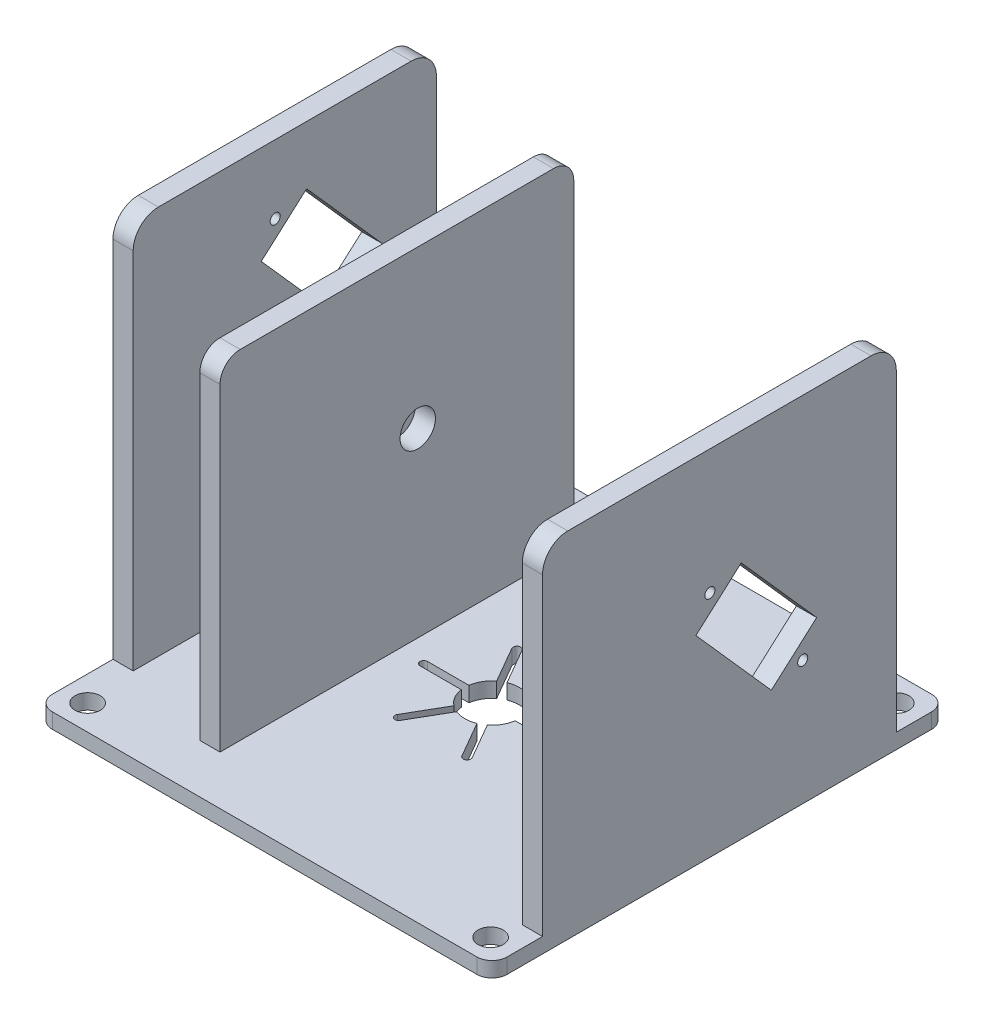
from build123d import *

# Parameters (mm, degrees)
SKETCH1_W           = 4
SKETCH1_H           = 70
SKETCH1_H_2         = 60
BOSS_EXTRUDE1_DEPTH = 3
SKETCH1_3_W         = 4
SKETCH1_3_H         = 60
SKETCH1_3_H_2       = 70
BOSS_EXTRUDE2_DEPTH = 70
SKETCH1_4_W         = 4
SKETCH1_4_H         = 70
BOSS_EXTRUDE3_DEPTH = 70
SKETCH5_R           = 4
CUT_EXTRUDE4_DEPTH  = 10
SKETCH6_R           = 2.5
CUT_EXTRUDE5_DEPTH  = 10
SKETCH1_5_W         = 4
SKETCH1_5_H         = 60
BOSS_EXTRUDE4_DEPTH = 80
SKETCH5_2_R         = 4
CUT_EXTRUDE6_DEPTH  = 10
FILLET1_R           = 3
FILLET2_R           = 5
FILLET3_R           = 4
SKETCH7_R           = 2.5
CUT_EXTRUDE7_DEPTH  = 10
SKETCH8_R           = 2.5
CUT_EXTRUDE8_DEPTH  = 10
CUT_EXTRUDE9_REACH  = 132.084
SKETCH9_R           = 3.5
SKETCH26_R          = 2.5
CUT_EXTRUDE11_DEPTH = 10
CUT_EXTRUDE14_DEPTH = 10
CUT_EXTRUDE15_DEPTH = 10
SKETCH28_R          = 1
SKETCH28_R_2        = 4
CUT_EXTRUDE16_DEPTH = 4
SKETCH29_R          = 1
SKETCH29_R_2        = 3.5
CUT_EXTRUDE18_DEPTH = 4
SKETCH31_R          = 5.375
CUT_EXTRUDE19_DEPTH = 10


with BuildPart() as part:
    # Sketch1 → Boss-Extrude1 (new body)
    # profile 1 of 4: a face of its own
    with BuildSketch(Plane(origin=(0, 0, 0), x_dir=(1, 0, 0), z_dir=(0, 1, 0))):
        Polygon((-50.771305032, 49.212548619), (-50.771305032, 34.212548619), (-46.771305032, 34.212548619), (-46.771305032, -25.787451381), (-50.771305032, -25.787451381), (-50.771305032, -40.787451381), (39.228694968, -40.787451381), (39.228694968, -30.787451381), (35.228694968, -30.787451381), (35.228694968, 39.212548619), (39.228694968, 39.212548619), (39.228694968, 49.212548619), align=None)
        with Locations((-26.271305032, 3.893815937)):
            Rectangle(SKETCH1_W, SKETCH1_H, mode=Mode.SUBTRACT)
    # profile 2 of 4: a face of its own
    with BuildSketch(Plane(origin=(0, 0, 0), x_dir=(1, 0, 0), z_dir=(0, 1, 0))):
        with Locations((37.228694968, 4.212548619)):
            Rectangle(SKETCH1_W, SKETCH1_H)
    # profile 3 of 4: a face of its own
    with BuildSketch(Plane(origin=(0, 0, 0), x_dir=(1, 0, 0), z_dir=(0, 1, 0))):
        with Locations((-48.771305032, 4.212548619)):
            Rectangle(SKETCH1_W, SKETCH1_H_2)
    # profile 4 of 4: a face of its own
    with BuildSketch(Plane(origin=(0, 0, 0), x_dir=(1, 0, 0), z_dir=(0, 1, 0))):
        with Locations((-26.271305032, 3.893815937)):
            Rectangle(SKETCH1_W, SKETCH1_H)
    extrude(amount=BOSS_EXTRUDE1_DEPTH)

    # Sketch1<3> → Boss-Extrude2 (add)
    with BuildSketch(Plane(origin=(0, 0, 0), x_dir=(1, 0, 0), z_dir=(0, 1, 0))):
        with Locations((-48.771305032, 4.212548619)):
            Rectangle(SKETCH1_3_W, SKETCH1_3_H)
        with Locations((37.228694968, 4.212548619)):
            Rectangle(SKETCH1_3_W, SKETCH1_3_H_2)
    extrude(amount=BOSS_EXTRUDE2_DEPTH)

    # Sketch1<4> → Boss-Extrude3 (add)
    with BuildSketch(Plane(origin=(0, 0, 0), x_dir=(1, 0, 0), z_dir=(0, 1, 0))):
        with Locations((-26.271305032, 3.893815937)):
            Rectangle(SKETCH1_4_W, SKETCH1_4_H)
    extrude(amount=BOSS_EXTRUDE3_DEPTH)

    # Sketch5 → Cut-Extrude4 (cut)
    with BuildSketch(Plane.ZY.offset(50.771305032)):
        with Locations((-8.022548619, 60)):
            Circle(SKETCH5_R)
    extrude(amount=-CUT_EXTRUDE4_DEPTH, mode=Mode.SUBTRACT)

    # Sketch6 → Cut-Extrude5 (cut)
    with BuildSketch(Plane(origin=(0, 3, 0), x_dir=(1, 0, 0), z_dir=(0, 1, 0))):
        with Locations(Location((-45.787574368, -35.787451381, 0), (0, 0, 270))):
            Circle(SKETCH6_R)
        with Locations(Location((-45.787574368, 44.212548619, 0), (0, 0, 270))):
            Circle(SKETCH6_R)
        with Locations((43.718511914, 44.212548619)):
            Circle(SKETCH6_R)
        with Locations((43.718511914, -35.787451381)):
            Circle(SKETCH6_R)
    extrude(amount=-CUT_EXTRUDE5_DEPTH, mode=Mode.SUBTRACT)

    # Sketch1<5> → Boss-Extrude4 (add)
    with BuildSketch(Plane(origin=(0, 0, 0), x_dir=(1, 0, 0), z_dir=(0, 1, 0))):
        with Locations((-48.771305032, 4.212548619)):
            Rectangle(SKETCH1_5_W, SKETCH1_5_H)
    extrude(amount=BOSS_EXTRUDE4_DEPTH)

    # Sketch5<2> → Cut-Extrude6 (cut)
    with BuildSketch(Plane.ZY.offset(50.771305032)):
        with Locations((-8.022548619, 60)):
            Circle(SKETCH5_2_R)
    extrude(amount=-CUT_EXTRUDE6_DEPTH, mode=Mode.SUBTRACT)

    # Fillet1
    fillet1_edges = [part.edges().sort_by_distance(p)[0] for p in [
        (-50.771305032, 1.5, 40.787451381),
        (-50.771305032, 1.5, -49.212548619),
        (39.228694968, 1.5, -49.212548619),
        (39.228694968, 1.5, 40.787451381),
    ]]
    fillet(fillet1_edges, radius=FILLET1_R)

    # Fillet2
    fillet2_edges = [part.edges().sort_by_distance(p)[0] for p in [
        (-48.771305032, 80, -34.212548619),
        (-48.771305032, 80, 25.787451381),
        (37.228694968, 70, -39.212548619),
        (37.228694968, 70, 30.787451381),
    ]]
    fillet(fillet2_edges, radius=FILLET2_R)

    # Fillet3
    fillet3_edges = [part.edges().sort_by_distance(p)[0] for p in [
        (-26.271305032, 70, 31.106184063),
        (-26.271305032, 70, -38.893815937),
    ]]
    fillet(fillet3_edges, radius=FILLET3_R)

    # Sketch7 → Cut-Extrude7 (cut)
    with BuildSketch(Plane(origin=(39.228694968, 0, 0), x_dir=(0, 0, -1), z_dir=(1, 0, 0))):
        with Locations((27.482306935, -10)):
            Circle(SKETCH7_R)
    extrude(amount=-CUT_EXTRUDE7_DEPTH, mode=Mode.SUBTRACT)

    # Sketch8 → Cut-Extrude8 (cut)
    with BuildSketch(Plane(origin=(39.228694968, 0, 0), x_dir=(0, 0, -1), z_dir=(1, 0, 0))):
        with Locations((8.02072759, 38.893893193)):
            Circle(SKETCH8_R)
    extrude(amount=-CUT_EXTRUDE8_DEPTH, mode=Mode.SUBTRACT)

    # Cut-Extrude9: up to this face of the body (flat: up to its plane)
    cut_extrude9_end = Plane(part.part.faces().sort_by_distance((-28.271305032, 36.452186393, -3.893815937))[0])
    # Sketch9 → Cut-Extrude9 (cut, up to the picked face)
    with BuildSketch(Plane(origin=(39.228694968, 0, 0), x_dir=(0, 0, -1), z_dir=(1, 0, 0)), mode=Mode.PRIVATE) as cut_extrude9_sk1:
        with Locations((8.02072759, 38.893893193)):
            Circle(SKETCH9_R)
    cut_extrude9_tool1 = split(extrude(cut_extrude9_sk1.sketch, amount=-CUT_EXTRUDE9_REACH, mode=Mode.PRIVATE), bisect_by=cut_extrude9_end, keep=Keep.BOTH, mode=Mode.PRIVATE)
    add(cut_extrude9_tool1.solids().sort_by(Axis((39.228695, 38.893893, -8.020728), (-1, 0, 0)))[0], mode=Mode.SUBTRACT)

    # Sketch26 → Cut-Extrude11 (cut)
    with BuildSketch(Plane(origin=(0, 3, 0), x_dir=(1, 0, 0), z_dir=(0, 1, 0))):
        with Locations(Location((34.228694968, -36.063353705, 0), (0, 0, 270))):
            Circle(SKETCH26_R)
        with Locations(Location((34.228694968, 44.212548619, 0), (0, 0, 270))):
            Circle(SKETCH26_R)
    extrude(amount=-CUT_EXTRUDE11_DEPTH, mode=Mode.SUBTRACT)

    # Sketch27 → Cut-Extrude14 (cut)
    with BuildSketch(Plane(origin=(0, 3, 0), x_dir=(1, 0, 0), z_dir=(0, 1, 0))):
        with BuildLine():
            Line((7.728694968, 3.462548619), (-19.271305032, 3.462548619))
            ThreePointArc((-19.271305032, 3.462548619), (-20.021305032, 4.212548619), (-19.271305032, 4.962548619))
            Line((-19.271305032, 4.962548619), (7.728694968, 4.962548619))
            ThreePointArc((7.728694968, 4.962548619), (8.478694968, 4.212548619), (7.728694968, 3.462548619))
        make_face()
        with BuildLine():
            Line((0.329175915, -7.853794332), (-13.170824085, 15.52889157))
            ThreePointArc((-13.170824085, 15.52889157), (-12.896305032, 16.553410623), (-11.871785979, 16.27889157))
            Line((-11.871785979, 16.27889157), (1.628214021, -7.103794332))
            ThreePointArc((1.628214021, -7.103794332), (1.353694968, -8.128313385), (0.329175915, -7.853794332))
        make_face()
        with BuildLine():
            Line((-13.170824085, -7.103794332), (0.329175915, 16.27889157))
            ThreePointArc((0.329175915, 16.27889157), (1.353694968, 16.553410623), (1.628214021, 15.52889157))
            Line((1.628214021, 15.52889157), (-11.871785979, -7.853794332))
            ThreePointArc((-11.871785979, -7.853794332), (-12.896305032, -8.128313385), (-13.170824085, -7.103794332))
        make_face()
    extrude(amount=-CUT_EXTRUDE14_DEPTH, mode=Mode.SUBTRACT)

    # Sketch27<7> → Cut-Extrude15 (cut)
    with BuildSketch(Plane(origin=(0, 3, 0), x_dir=(1, 0, 0), z_dir=(0, 1, 0))):
        with BuildLine():
            Line((-7.743699741, 2.296260771), (-7.070343138, 3.462548619))
            Line((-7.070343138, 3.462548619), (-8.417056343, 3.462548619))
            ThreePointArc((-8.417056343, 3.462548619), (-8.152874893, 2.837548619), (-7.743699741, 2.296260771))
        make_face()
        with BuildLine():
            Line((-8.417056343, 4.962548619), (-7.070343138, 4.962548619))
            Line((-7.070343138, 4.962548619), (-7.743699741, 6.128836466))
            ThreePointArc((-7.743699741, 6.128836466), (-8.152874893, 5.587548619), (-8.417056343, 4.962548619))
        make_face()
        with BuildLine():
            Line((-5.771305032, 5.712548619), (-5.09794843, 6.878836466))
            ThreePointArc((-5.09794843, 6.878836466), (-5.771305032, 6.962548619), (-6.444661635, 6.878836466))
            Line((-6.444661635, 6.878836466), (-5.771305032, 5.712548619))
        make_face()
        with BuildLine():
            Line((-4.472266927, 4.962548619), (-3.125553721, 4.962548619))
            ThreePointArc((-3.125553721, 4.962548619), (-3.389735172, 5.587548619), (-3.798910324, 6.128836466))
            Line((-3.798910324, 6.128836466), (-4.472266927, 4.962548619))
        make_face()
        with BuildLine():
            ThreePointArc((-3.798910324, 2.296260771), (-3.389735172, 2.837548619), (-3.125553721, 3.462548619))
            Line((-3.125553721, 3.462548619), (-4.472266927, 3.462548619))
            Line((-4.472266927, 3.462548619), (-3.798910324, 2.296260771))
        make_face()
        with BuildLine():
            ThreePointArc((-6.444661635, 1.546260771), (-5.771305032, 1.462548619), (-5.09794843, 1.546260771))
            Line((-5.09794843, 1.546260771), (-5.771305032, 2.712548619))
            Line((-5.771305032, 2.712548619), (-6.444661635, 1.546260771))
        make_face()
    extrude(amount=-CUT_EXTRUDE15_DEPTH, mode=Mode.SUBTRACT)

    # Sketch28 → Cut-Extrude16 (cut)
    # profile 1 of 3: a face of its own
    with BuildSketch(Plane.ZY.offset(50.771305032)):
        with Locations((-2.316893756, 66.434710762)):
            Circle(SKETCH28_R)
    # profile 2 of 3: a face of its own
    with BuildSketch(Plane.ZY.offset(50.771305032)):
        with Locations((-20.69441, 45.708956331)):
            Circle(SKETCH28_R)
    # profile 3 of 3: a face of its own
    with BuildSketch(Plane.ZY.offset(50.771305032)):
        Polygon((-23.458777666, 51.635023443), (-8.531192269, 68.470022529), (0.44747391, 60.508643651), (-14.480111487, 43.673644564), align=None)
        with Locations((-8.022548619, 60)):
            Circle(SKETCH28_R_2, mode=Mode.SUBTRACT)
    extrude(amount=-CUT_EXTRUDE16_DEPTH, mode=Mode.SUBTRACT)

    # Sketch29 → Cut-Extrude18 (cut)
    # profile 1 of 3: a face of its own
    with BuildSketch(Plane(origin=(39.228694968, 0, 0), x_dir=(0, 0, -1), z_dir=(1, 0, 0))):
        with Locations((2.315072727, 45.328603955)):
            Circle(SKETCH29_R)
    # profile 2 of 3: a face of its own
    with BuildSketch(Plane(origin=(39.228694968, 0, 0), x_dir=(0, 0, -1), z_dir=(1, 0, 0))):
        with Locations((20.692588971, 24.602849525)):
            Circle(SKETCH29_R)
    # profile 3 of 3: a face of its own
    with BuildSketch(Plane(origin=(39.228694968, 0, 0), x_dir=(0, 0, -1), z_dir=(1, 0, 0))):
        Polygon((8.529371241, 47.363915722), (23.456956637, 30.528916636), (14.478290458, 22.567537758), (-0.449294939, 39.402536844), align=None)
        with Locations((8.02072759, 38.893893193)):
            Circle(SKETCH29_R_2, mode=Mode.SUBTRACT)
    extrude(amount=-CUT_EXTRUDE18_DEPTH, mode=Mode.SUBTRACT)

    # Sketch31 → Cut-Extrude19 (cut)
    with BuildSketch(Plane(origin=(0, 3, 0), x_dir=(1, 0, 0), z_dir=(0, 1, 0))):
        with Locations((-5.771305032, 4.212548619)):
            Circle(SKETCH31_R)
    extrude(amount=-CUT_EXTRUDE19_DEPTH, mode=Mode.SUBTRACT)


solid = part.part
